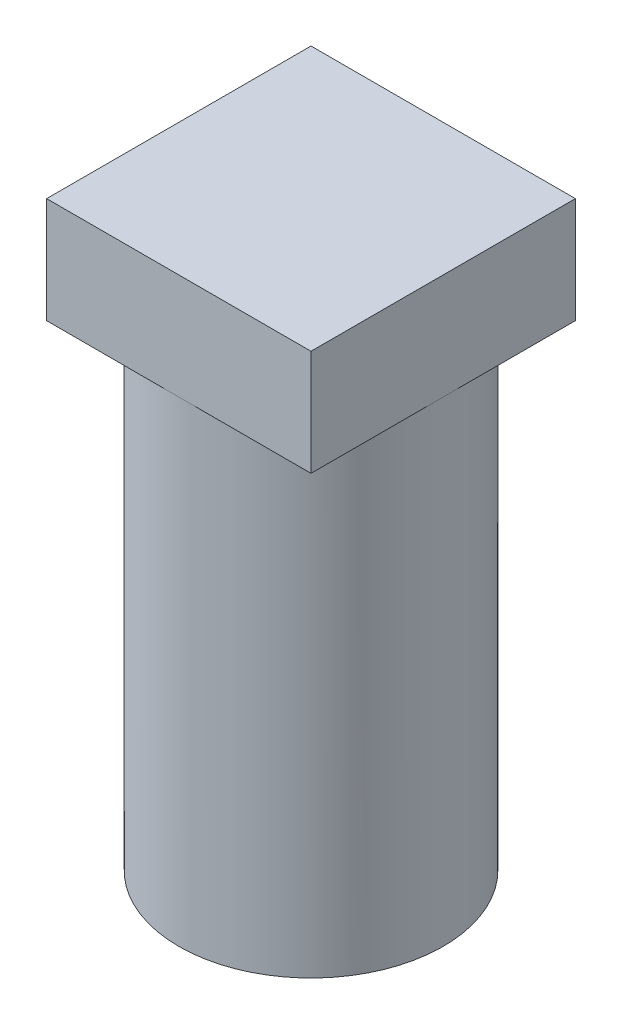
from build123d import *

# Parameters (mm, degrees)
SKETCH1_R           = 2.5
BOSS_EXTRUDE1_DEPTH = 9
SKETCH2_W           = 5
SKETCH2_H           = 5
BOSS_EXTRUDE2_DEPTH = 2
SCALE1_SCALE        = 2


with BuildPart() as part:
    # Sketch1 → Boss-Extrude1 (new body)
    with BuildSketch(Plane(origin=(0, 0, 0), x_dir=(1, 0, 0), z_dir=(0, 1, 0))):
        with Locations(Location((0, 0, 0), (0, 0, 270))):
            Circle(SKETCH1_R)
    extrude(amount=BOSS_EXTRUDE1_DEPTH)

    # Sketch2 → Boss-Extrude2 (add)
    with BuildSketch(Plane(origin=(0, 9, 0), x_dir=(1, 0, 0), z_dir=(0, 1, 0))):
        Rectangle(SKETCH2_W, SKETCH2_H)
    extrude(amount=BOSS_EXTRUDE2_DEPTH)


with BuildPart() as part_1:
    # Scale1: scaled about (0, 5.712978856, 0)
    add(part.part.scale(SCALE1_SCALE).moved(Location((0, -5.712978856, 0))))


solid = part_1.part
